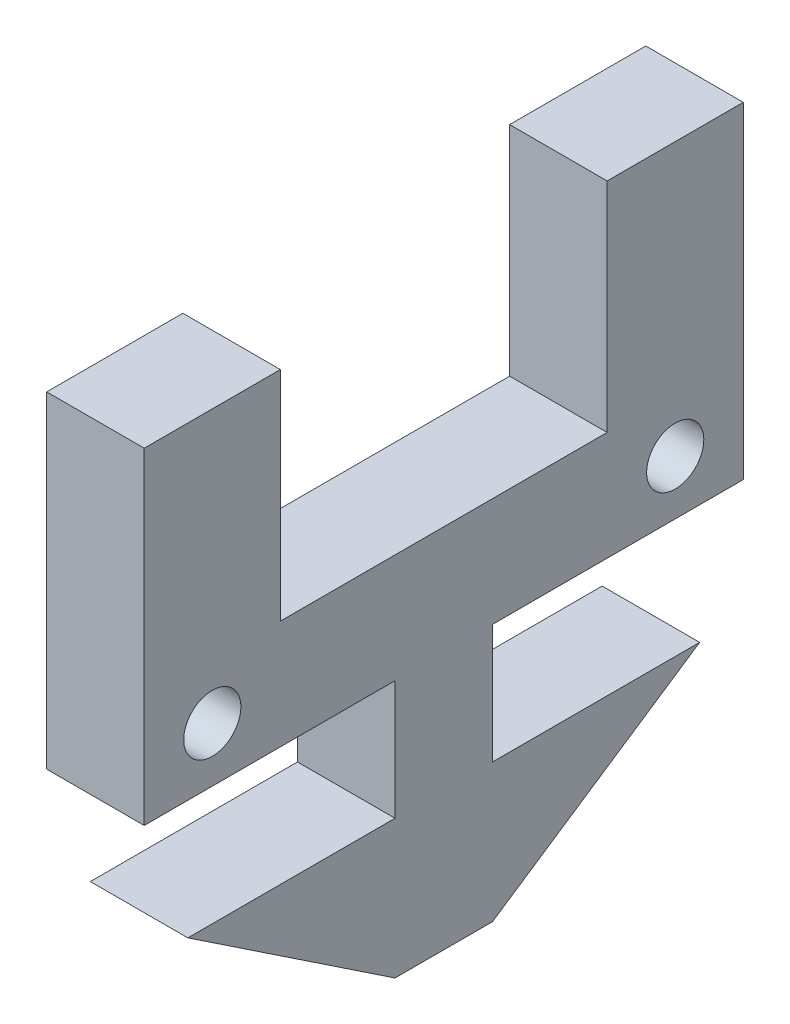
from build123d import *

# Parameters (mm, degrees)
BOSS_EXTRUDE1_DEPTH = 3.5814
SKETCH7_R           = 1.05
CUT_EXTRUDE5_DEPTH  = 14.03174685
BOSS_EXTRUDE3_DEPTH = 3.5814


with BuildPart() as part:
    # Sketch1 → Boss-Extrude1 (new body)
    with BuildSketch(Plane(origin=(0, 0, 0), x_dir=(0, 0, -1), z_dir=(1, 0, 0))):
        Polygon((-6, 6), (-6, -2), (6, -2), (6, 6), (11, 6), (11, -6), (-11, -6), (-11, 6), align=None)
    extrude(amount=BOSS_EXTRUDE1_DEPTH)

    # Sketch7 → Cut-Extrude5 (cut, through all)
    with BuildSketch(Plane(origin=(3.5814, 0, 0), x_dir=(0, 0, -1), z_dir=(1, 0, 0))):
        with Locations((-8.5, -4)):
            Circle(SKETCH7_R)
        with Locations((8.5, -4)):
            Circle(SKETCH7_R)
    extrude(amount=-CUT_EXTRUDE5_DEPTH, mode=Mode.SUBTRACT)

    # Sketch8 → Boss-Extrude3 (add)
    with BuildSketch(Plane(origin=(0, 0, 0), x_dir=(0, 0, -1), z_dir=(1, 0, 0))):
        Polygon((-1.7907, -10.3749976), (-9.398, -10.3749976), (-1.7907, -15.4549976), (1.7907, -15.4549976), (9.398, -10.3749976), (1.7907, -10.3749976), (1.7907, -6), (-1.7907, -6), align=None)
    extrude(amount=BOSS_EXTRUDE3_DEPTH)


solid = part.part
